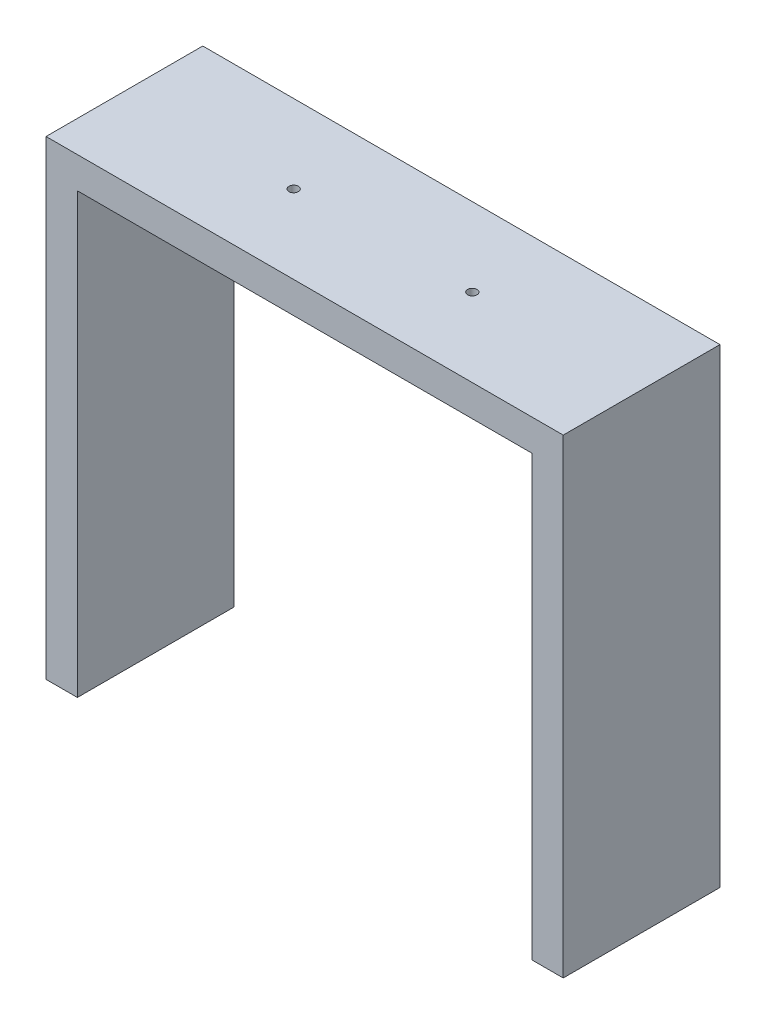
from build123d import *

# Parameters (mm, degrees)
BOSS_EXTRUDE1_DEPTH     = 50
SKETCH2_R               = 4
CUT_EXTRUDE1_DEPTH      = 50
CUT_EXTRUDE2_DEPTH      = 347.013005536
CUT_EXTRUDE2_DEPTH_BACK = 347.013005536
SKETCH3_R               = 3


with BuildPart() as part:
    # Sketch1 → Boss-Extrude1 (new, symmetric)
    with BuildSketch(Plane.XY):
        Polygon((-165, 0), (-145, 0), (-145, 280), (145, 280), (145, 0), (165, 0), (165, 300), (-165, 300), align=None)
    extrude(amount=BOSS_EXTRUDE1_DEPTH, both=True)

    # Sketch2 → Cut-Extrude1 (cut)
    with BuildSketch(Plane.XZ):
        with Locations((-155, 0)):
            Circle(SKETCH2_R)
        with Locations(Location((155, 0, 0), (0, 0, 180))):
            Circle(SKETCH2_R)
    extrude(amount=-CUT_EXTRUDE1_DEPTH, mode=Mode.SUBTRACT)

    # Sketch3 → Cut-Extrude2 (cut, two sides: drawn at the far end of the back side and taken through both)
    with BuildSketch(Plane(origin=(0, 300, 0), x_dir=(1, 0, 0), z_dir=(0, 1, 0)).offset(-CUT_EXTRUDE2_DEPTH_BACK)):
        with Locations(Location((-57, 0, 0), (0, 0, 270))):
            Circle(SKETCH3_R)
        with Locations(Location((57, 0, 0), (0, 0, 270))):
            Circle(SKETCH3_R)
    extrude(amount=CUT_EXTRUDE2_DEPTH + CUT_EXTRUDE2_DEPTH_BACK, mode=Mode.SUBTRACT)


solid = part.part
